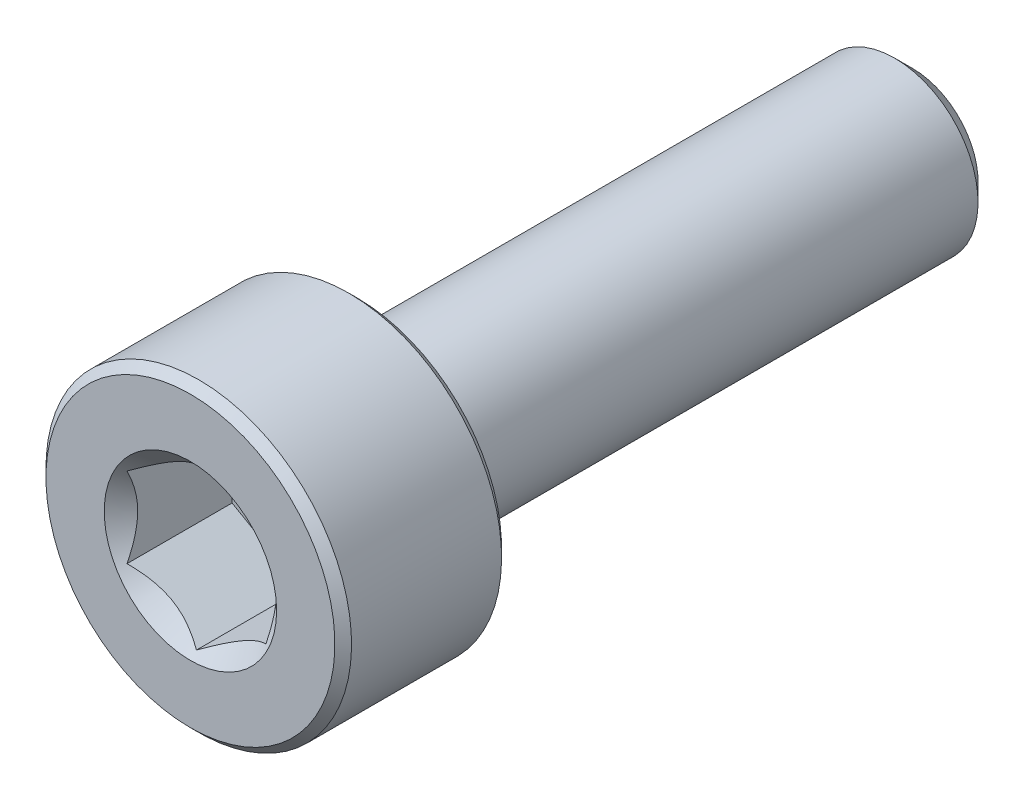
from build123d import *

# Parameters (mm, degrees)
CUT_EXTRUDE1_DEPTH = 2
SKETCH4_R          = 1.551628848
CUT_EXTRUDE2_DEPTH = 1.5
CUT_EXTRUDE2_DRAFT = -45


with BuildPart() as part:
    # Sketch2 → Revolve1 (revolve)
    with BuildSketch(Plane(origin=(0, 0, 0), x_dir=(0, 0, -1), z_dir=(1, 0, 0))):
        with BuildLine():
            Line((-6.5, 0), (-6.5, 2.6))
            Line((-6.5, 2.6), (-6.35, 2.75))
            Line((-6.35, 2.75), (-3.65, 2.75))
            Line((-3.65, 2.75), (-3.5, 2.6))
            Line((-3.5, 2.6), (-3.5, 1.65))
            ThreePointArc((-3.5, 1.65), (-3.456066017, 1.543933983), (-3.35, 1.5))
            Line((-3.35, 1.5), (6.175240474, 1.5))
            Line((6.175240474, 1.5), (6.5, 1.175240474))
            Line((6.5, 1.175240474), (6.5, 0))
            Line((6.5, 0), (-6.5, 0))
        make_face()
    revolve(axis=Axis((0, 0, -6.5), (0, 0, 1)))

    # Sketch3 → Cut-Extrude1 (cut)
    with BuildSketch(Plane.XY.offset(6.5)):
        Polygon((1.25, -0.721687836), (1.25, 0.721687836), (0, 1.443375673), (-1.25, 0.721687836), (-1.25, -0.721687836), (0, -1.443375673), align=None)
    extrude(amount=-CUT_EXTRUDE1_DEPTH, mode=Mode.SUBTRACT)


with BuildPart() as cut_extrude2_tool:
    # Sketch4 → Cut-Extrude2 (with draft: the straight prism first)
    with BuildSketch(Plane.XY.offset(6.5)):
        Circle(SKETCH4_R)
    extrude(amount=-CUT_EXTRUDE2_DEPTH)
    # Cut-Extrude2: the draft: its side faces are tilted about the plane it starts from
    cut_extrude2_sides = [cut_extrude2_tool.faces().sort_by_distance(p)[0] for p in [
        (-1.551628848, 0, 5.75),
    ]]
    draft(cut_extrude2_sides, Plane.XY.offset(6.5), CUT_EXTRUDE2_DRAFT)


with BuildPart() as part_1:
    add(part.part)

    # Cut-Extrude2: cut by cut_extrude2_tool
    add(cut_extrude2_tool.part, mode=Mode.SUBTRACT)


solid = part_1.part
